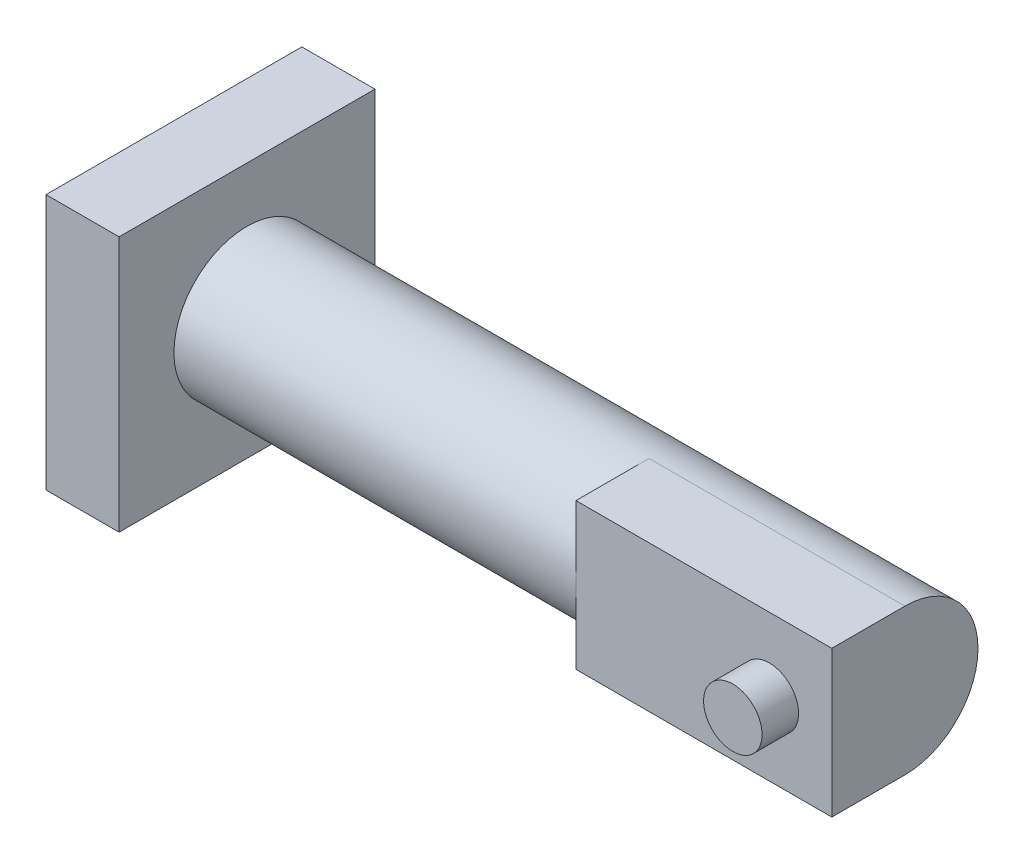
from build123d import *

# Parameters (mm, degrees)
SKETCH_1_R      = 10
EXTRUDE_1_DEPTH = 90
SKETCH_2_W      = 35
SKETCH_2_H      = 20
EXTRUDE_2_DEPTH = 10
SKETCH_3_R      = 4
EXTRUDE_3_DEPTH = 5
SKETCH_5_W      = 35
SKETCH_5_H      = 35
EXTRUDE_4_DEPTH = 10


with BuildPart() as part:
    # 草图1 → 凸台-拉伸1 (new body)
    with BuildSketch(Plane(origin=(0, 0, 0), x_dir=(0, 0, -1), z_dir=(1, 0, 0))):
        with Locations(Location((0, 0, 0), (0, 0, 180))):
            Circle(SKETCH_1_R)
    extrude(amount=EXTRUDE_1_DEPTH)

    # 草图2 → 凸台-拉伸2 (add)
    with BuildSketch(Plane.XY):
        with Locations((72.5, 0)):
            Rectangle(SKETCH_2_W, SKETCH_2_H)
    extrude(amount=EXTRUDE_2_DEPTH)

    # 草图3 → 凸台-拉伸3 (add)
    with BuildSketch(Plane.XY.offset(10)):
        with Locations((81.45858647, 0)):
            Circle(SKETCH_3_R)
    extrude(amount=EXTRUDE_3_DEPTH)

    # 草图5 → 凸台-拉伸4 (add)
    with BuildSketch(Plane.ZY):
        Rectangle(SKETCH_5_W, SKETCH_5_H)
    extrude(amount=EXTRUDE_4_DEPTH)


solid = part.part
